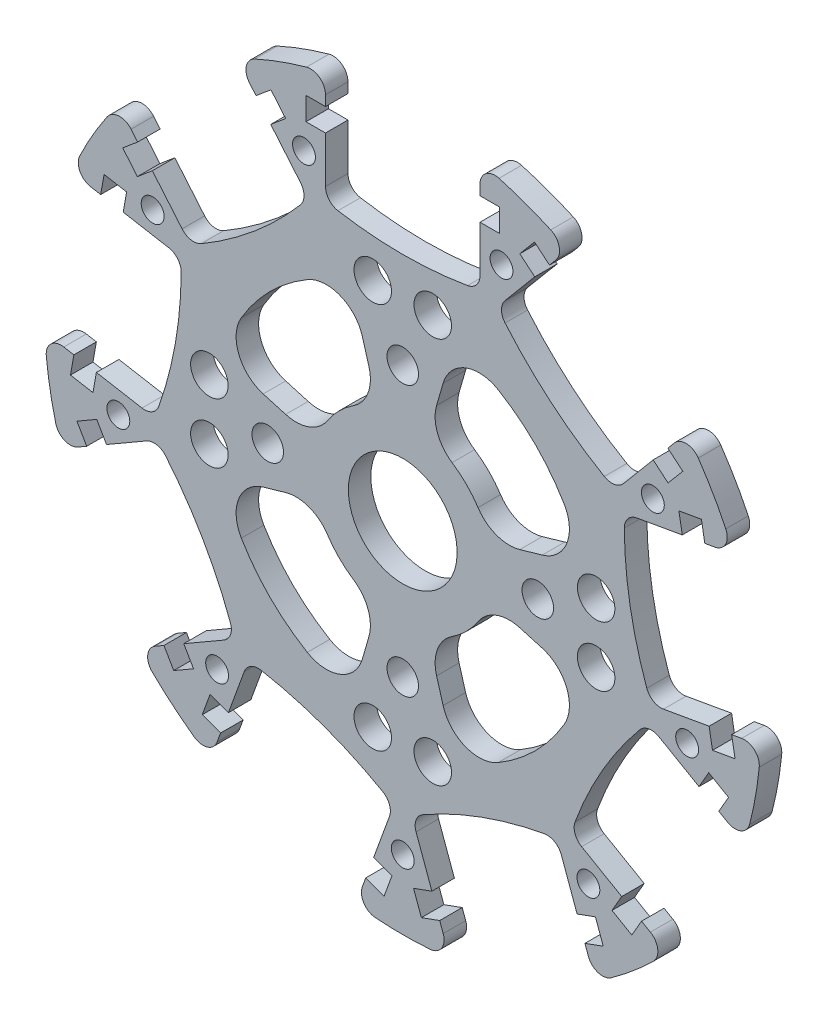
from build123d import *

# Parameters (mm, degrees)
SKETCH_1_R                       = 47.75
EXTRUDE_1_DEPTH                  = 3
CUT_EXTRUDE_1_DEPTH              = 68.595303091
FILLET_2_R                       = 2
SKETCH_3_R                       = 1.525
CUT_EXTRUDE_2_DEPTH              = 68.441458022
SKETCH_4_R                       = 2.1
SKETCH_4_R_2                     = 7.25
CUT_EXTRUDE_3_DEPTH              = 68.441458022
CUT_EXTRUDE_4_DEPTH              = 68.441458022
FILLET_3_R                       = 5
PATTERN_CIRCULAR_1_COUNT         = 4
FILLET_3_OF_PATTERN_CIRCULAR_1_R = 5
SKETCH_8_R                       = 2.5
CUT_EXTRUDE_5_DEPTH              = 68.441458022
PATTERN_CIRCULAR_2_COUNT         = 4


with BuildPart() as part:
    # ｽｹｯﾁ1 → ﾎﾞｽ - 押し出し1 (new body)
    with BuildSketch(Plane.XY):
        Circle(SKETCH_1_R)
    extrude(amount=EXTRUDE_1_DEPTH)

    # ｽｹｯﾁ2 → ｶｯﾄ - 押し出し1 (cut, through all)
    with BuildSketch(Plane.XY.offset(3)):
        with BuildLine():
            Line((-10.3, 46.625878008), (-10.3, 42.705))
            Line((-10.3, 42.705), (-12.9, 42.705))
            Line((-12.9, 42.705), (-12.9, 39.655))
            Line((-12.9, 39.655), (-10.3, 39.655))
            Line((-10.3, 39.655), (-10.3, 31.825692416))
            ThreePointArc((-10.3, 31.825692416), (0, 30.78), (10.3, 31.825692416))
            Line((10.3, 31.825692416), (10.3, 39.655))
            Line((10.3, 39.655), (12.9, 39.655))
            Line((12.9, 39.655), (12.9, 42.705))
            Line((12.9, 42.705), (10.3, 42.705))
            Line((10.3, 42.705), (10.3, 46.625878008))
            ThreePointArc((10.3, 46.625878008), (0, 47.75), (-10.3, 46.625878008))
        make_face()
        with BuildLine():
            Line((17.599484898, 36.998204772), (12.566902991, 31.000607203))
            ThreePointArc((12.566902991, 31.000607203), (19.785002626, 23.578847959), (28.347418519, 17.759182444))
            Line((28.347418519, 17.759182444), (33.380000426, 23.756780012))
            Line((33.380000426, 23.756780012), (35.371715978, 22.085532227))
            Line((35.371715978, 22.085532227), (37.332218188, 24.421967778))
            Line((37.332218188, 24.421967778), (35.340502636, 26.093215564))
            Line((35.340502636, 26.093215564), (37.860794438, 29.096782374))
            ThreePointArc((37.860794438, 29.096782374), (30.693108363, 36.578622159), (22.08027891, 42.338207133))
            Line((22.08027891, 42.338207133), (19.559987108, 39.334640323))
            Line((19.559987108, 39.334640323), (17.568271555, 41.005888108))
            Line((17.568271555, 41.005888108), (15.607769346, 38.669452557))
            Line((15.607769346, 38.669452557), (17.599484898, 36.998204772))
        make_face()
        with BuildLine():
            Line((37.263975216, 17.029538341), (29.553612406, 15.669993347))
            ThreePointArc((29.553612406, 15.669993347), (30.312382638, 5.344890909), (33.130764866, -4.617046365))
            Line((33.130764866, -4.617046365), (40.841127676, -3.257501371))
            Line((40.841127676, -3.257501371), (41.292612938, -5.818001528))
            Line((41.292612938, -5.818001528), (44.296276584, -5.288374587))
            Line((44.296276584, -5.288374587), (43.844791322, -2.727874429))
            Line((43.844791322, -2.727874429), (47.706102383, -2.047021108))
            ThreePointArc((47.706102383, -2.047021108), (47.024570206, 8.291700484), (44.128949923, 18.240018604))
            Line((44.128949923, 18.240018604), (40.267638862, 17.559165283))
            Line((40.267638862, 17.559165283), (39.8161536, 20.119665441))
            Line((39.8161536, 20.119665441), (36.812489954, 19.590038499))
            Line((36.812489954, 19.590038499), (37.263975216, 17.029538341))
        make_face()
        with BuildLine():
            Line((39.492237387, -10.907438341), (32.711858125, -6.992784549))
            ThreePointArc((32.711858125, -6.992784549), (26.656261928, -15.39), (22.411858125, -24.832907867))
            Line((22.411858125, -24.832907867), (29.192237387, -28.747561659))
            Line((29.192237387, -28.747561659), (27.892237387, -30.999227709))
            Line((27.892237387, -30.999227709), (30.533614869, -32.524227709))
            Line((30.533614869, -32.524227709), (31.833614869, -30.272561659))
            Line((31.833614869, -30.272561659), (35.229194829, -32.233000663))
            ThreePointArc((35.229194829, -32.233000663), (41.352713031, -23.875), (45.529194829, -14.392877345))
            Line((45.529194829, -14.392877345), (42.133614869, -12.432438341))
            Line((42.133614869, -12.432438341), (43.433614869, -10.180772291))
            Line((43.433614869, -10.180772291), (40.792237387, -8.655772291))
            Line((40.792237387, -8.655772291), (39.492237387, -10.907438341))
        make_face()
        with BuildLine():
            Line((23.241642778, -33.740703401), (20.563861876, -26.383560838))
            ThreePointArc((20.563861876, -26.383560838), (10.527380012, -28.923738868), (1.206193887, -33.429175791))
            Line((1.206193887, -33.429175791), (3.883974789, -40.786318354))
            Line((3.883974789, -40.786318354), (1.440773975, -41.675570726))
            Line((1.440773975, -41.675570726), (2.483935413, -44.54163322))
            Line((2.483935413, -44.54163322), (4.927136227, -43.652380847))
            Line((4.927136227, -43.652380847), (6.268155485, -47.336800978))
            ThreePointArc((6.268155485, -47.336800978), (16.331461844, -44.870322643), (25.625823473, -40.291186025))
            Line((25.625823473, -40.291186025), (24.284804215, -36.606765894))
            Line((24.284804215, -36.606765894), (26.728005029, -35.717513522))
            Line((26.728005029, -35.717513522), (25.684843592, -32.851451028))
            Line((25.684843592, -32.851451028), (23.241642778, -33.740703401))
        make_face()
        with BuildLine():
            Line((-3.883974789, -40.786318354), (-1.206193887, -33.429175791))
            ThreePointArc((-1.206193887, -33.429175791), (-10.527380012, -28.923738868), (-20.563861876, -26.383560838))
            Line((-20.563861876, -26.383560838), (-23.241642778, -33.740703401))
            Line((-23.241642778, -33.740703401), (-25.684843592, -32.851451028))
            Line((-25.684843592, -32.851451028), (-26.728005029, -35.717513522))
            Line((-26.728005029, -35.717513522), (-24.284804215, -36.606765894))
            Line((-24.284804215, -36.606765894), (-25.625823473, -40.291186025))
            ThreePointArc((-25.625823473, -40.291186025), (-16.331461844, -44.870322643), (-6.268155485, -47.336800978))
            Line((-6.268155485, -47.336800978), (-4.927136227, -43.652380847))
            Line((-4.927136227, -43.652380847), (-2.483935413, -44.54163322))
            Line((-2.483935413, -44.54163322), (-1.440773975, -41.675570726))
            Line((-1.440773975, -41.675570726), (-3.883974789, -40.786318354))
        make_face()
        with BuildLine():
            Line((-29.192237387, -28.747561659), (-22.411858125, -24.832907867))
            ThreePointArc((-22.411858125, -24.832907867), (-26.656261928, -15.39), (-32.711858125, -6.992784549))
            Line((-32.711858125, -6.992784549), (-39.492237387, -10.907438341))
            Line((-39.492237387, -10.907438341), (-40.792237387, -8.655772291))
            Line((-40.792237387, -8.655772291), (-43.433614869, -10.180772291))
            Line((-43.433614869, -10.180772291), (-42.133614869, -12.432438341))
            Line((-42.133614869, -12.432438341), (-45.529194829, -14.392877345))
            ThreePointArc((-45.529194829, -14.392877345), (-41.352713031, -23.875), (-35.229194829, -32.233000663))
            Line((-35.229194829, -32.233000663), (-31.833614869, -30.272561659))
            Line((-31.833614869, -30.272561659), (-30.533614869, -32.524227709))
            Line((-30.533614869, -32.524227709), (-27.892237387, -30.999227709))
            Line((-27.892237387, -30.999227709), (-29.192237387, -28.747561659))
        make_face()
        with BuildLine():
            Line((-40.841127676, -3.257501371), (-33.130764866, -4.617046365))
            ThreePointArc((-33.130764866, -4.617046365), (-30.312382638, 5.344890909), (-29.553612406, 15.669993347))
            Line((-29.553612406, 15.669993347), (-37.263975216, 17.029538341))
            Line((-37.263975216, 17.029538341), (-36.812489954, 19.590038499))
            Line((-36.812489954, 19.590038499), (-39.8161536, 20.119665441))
            Line((-39.8161536, 20.119665441), (-40.267638862, 17.559165283))
            Line((-40.267638862, 17.559165283), (-44.128949923, 18.240018604))
            ThreePointArc((-44.128949923, 18.240018604), (-47.024570206, 8.291700484), (-47.706102383, -2.047021108))
            Line((-47.706102383, -2.047021108), (-43.844791322, -2.727874429))
            Line((-43.844791322, -2.727874429), (-44.296276584, -5.288374587))
            Line((-44.296276584, -5.288374587), (-41.292612938, -5.818001528))
            Line((-41.292612938, -5.818001528), (-40.841127676, -3.257501371))
        make_face()
        with BuildLine():
            Line((-33.380000426, 23.756780012), (-28.347418519, 17.759182444))
            ThreePointArc((-28.347418519, 17.759182444), (-19.785002626, 23.578847959), (-12.566902991, 31.000607203))
            Line((-12.566902991, 31.000607203), (-17.599484898, 36.998204772))
            Line((-17.599484898, 36.998204772), (-15.607769346, 38.669452557))
            Line((-15.607769346, 38.669452557), (-17.568271555, 41.005888108))
            Line((-17.568271555, 41.005888108), (-19.559987108, 39.334640323))
            Line((-19.559987108, 39.334640323), (-22.08027891, 42.338207133))
            ThreePointArc((-22.08027891, 42.338207133), (-30.693108363, 36.578622159), (-37.860794438, 29.096782374))
            Line((-37.860794438, 29.096782374), (-35.340502636, 26.093215564))
            Line((-35.340502636, 26.093215564), (-37.332218188, 24.421967778))
            Line((-37.332218188, 24.421967778), (-35.371715978, 22.085532227))
            Line((-35.371715978, 22.085532227), (-33.380000426, 23.756780012))
        make_face()
    extrude(amount=-CUT_EXTRUDE_1_DEPTH, mode=Mode.SUBTRACT)

    # ﾌｨﾚｯﾄ2
    fillet_2_edges = [part.edges().sort_by_distance(p)[0] for p in [
        (-47.706102383, -2.047021108, 1.5),
        (-44.128949923, 18.240018604, 1.5),
        (-29.553612406, 15.669993347, 1.5),
        (-33.130764866, -4.617046365, 1.5),
        (-37.860794438, 29.096782374, 1.5),
        (-22.08027891, 42.338207133, 1.5),
        (-12.566902991, 31.000607203, 1.5),
        (-28.347418519, 17.759182444, 1.5),
        (-6.268155485, -47.336800978, 1.5),
        (-25.625823473, -40.291186025, 1.5),
        (-20.563861876, -26.383560838, 1.5),
        (-1.206193887, -33.429175791, 1.5),
        (-35.229194829, -32.233000663, 1.5),
        (-45.529194829, -14.392877345, 1.5),
        (-32.711858125, -6.992784549, 1.5),
        (-22.411858125, -24.832907867, 1.5),
        (45.529194829, -14.392877345, 1.5),
        (35.229194829, -32.233000663, 1.5),
        (22.411858125, -24.832907867, 1.5),
        (32.711858125, -6.992784549, 1.5),
        (25.625823473, -40.291186025, 1.5),
        (6.268155485, -47.336800978, 1.5),
        (1.206193887, -33.429175791, 1.5),
        (20.563861876, -26.383560838, 1.5),
        (22.08027891, 42.338207133, 1.5),
        (37.860794438, 29.096782374, 1.5),
        (28.347418519, 17.759182444, 1.5),
        (12.566902991, 31.000607203, 1.5),
        (44.128949923, 18.240018604, 1.5),
        (47.706102383, -2.047021108, 1.5),
        (33.130764866, -4.617046365, 1.5),
        (29.553612406, 15.669993347, 1.5),
        (-10.3, 46.625878008, 1.5),
        (10.3, 46.625878008, 1.5),
        (10.3, 31.825692416, 1.5),
        (-10.3, 31.825692416, 1.5),
    ]]
    fillet(fillet_2_edges, radius=FILLET_2_R)

    # ｽｹｯﾁ3 → ｶｯﾄ - 押し出し2 (cut, through all)
    with BuildSketch(Plane.XY.offset(3)):
        with Locations((0, -38.5)):
            Circle(SKETCH_3_R)
        with Locations((-24.747322973, -29.49271106)):
            Circle(SKETCH_3_R)
        with Locations((-37.915098491, -6.68545484)):
            Circle(SKETCH_3_R)
        with Locations((-33.341978046, 19.25)):
            Circle(SKETCH_3_R)
        with Locations((-13.167775518, 36.1781659)):
            Circle(SKETCH_3_R)
        with Locations((13.167775518, 36.1781659)):
            Circle(SKETCH_3_R)
        with Locations((33.341978046, 19.25)):
            Circle(SKETCH_3_R)
        with Locations((37.915098491, -6.68545484)):
            Circle(SKETCH_3_R)
        with Locations((24.747322973, -29.49271106)):
            Circle(SKETCH_3_R)
    extrude(amount=-CUT_EXTRUDE_2_DEPTH, mode=Mode.SUBTRACT)

    # ｽｹｯﾁ4 → ｶｯﾄ - 押し出し3 (cut, through all)
    with BuildSketch(Plane(origin=(0, 0, 0), x_dir=(-1, 0, 0), z_dir=(0, 0, -1))):
        with Locations((18, 0)):
            Circle(SKETCH_4_R)
        with Locations((0, -18)):
            Circle(SKETCH_4_R)
        with Locations((0, 18)):
            Circle(SKETCH_4_R)
        Circle(SKETCH_4_R_2)
        with Locations((-18, 0)):
            Circle(SKETCH_4_R)
    extrude(amount=-CUT_EXTRUDE_3_DEPTH, mode=Mode.SUBTRACT)

    # ｽｹｯﾁ7 → ｶｯﾄ - 押し出し4 (cut, through all)
    with BuildSketch(Plane(origin=(0, 0, 0), x_dir=(-1, 0, 0), z_dir=(0, 0, -1))):
        with BuildLine():
            Line((-3.333333333, 11.527744311), (-6.944444444, 24.01613398))
            ThreePointArc((-6.944444444, 24.01613398), (-17.67766953, 17.67766953), (-24.01613398, 6.944444444))
            Line((-24.01613398, 6.944444444), (-11.527744311, 3.333333333))
            ThreePointArc((-11.527744311, 3.333333333), (-8.485281374, 8.485281374), (-3.333333333, 11.527744311))
        make_face()
    cut_extrude_4 = extrude(amount=-CUT_EXTRUDE_4_DEPTH, mode=Mode.SUBTRACT)

    # ﾌｨﾚｯﾄ3
    fillet_3_edges = [part.edges().sort_by_distance(p)[0] for p in [
        (3.333333333, 11.527744311, 1.5),
        (11.527744311, 3.333333333, 1.5),
        (24.01613398, 6.944444444, 1.5),
        (6.944444444, 24.01613398, 1.5),
    ]]
    fillet(fillet_3_edges, radius=FILLET_3_R)

    # 円形ﾊﾟﾀｰﾝ1: ｶｯﾄ - 押し出し4 ×4 about axis
    pattern_circular_1_axis = Axis((0, 0, 0), (0, 0, 1))
    for i in range(1, PATTERN_CIRCULAR_1_COUNT):
        add(cut_extrude_4.rotate(pattern_circular_1_axis, i * 360 / PATTERN_CIRCULAR_1_COUNT), mode=Mode.SUBTRACT)

    # ﾌｨﾚｯﾄ3 of 円形ﾊﾟﾀｰﾝ1
    fillet_3_of_pattern_circular_1_edges = [part.edges().sort_by_distance(p)[0] for p in [
        (-11.527744311, 3.333333333, 1.5),
        (-3.333333333, 11.527744311, 1.5),
        (-6.944444444, 24.01613398, 1.5),
        (-24.01613398, 6.944444444, 1.5),
        (-3.333333333, -11.527744311, 1.5),
        (-11.527744311, -3.333333333, 1.5),
        (-24.01613398, -6.944444444, 1.5),
        (-6.944444444, -24.01613398, 1.5),
        (11.527744311, -3.333333333, 1.5),
        (3.333333333, -11.527744311, 1.5),
        (6.944444444, -24.01613398, 1.5),
        (24.01613398, -6.944444444, 1.5),
    ]]
    fillet(fillet_3_of_pattern_circular_1_edges, radius=FILLET_3_OF_PATTERN_CIRCULAR_1_R)

    # ｽｹｯﾁ8 → ｶｯﾄ - 押し出し5 (cut, through all)
    with BuildSketch(Plane(origin=(0, 0, 0), x_dir=(-1, 0, 0), z_dir=(0, 0, -1))):
        with Locations((-4, 25.78)):
            Circle(SKETCH_8_R)
        with Locations((4, 25.78)):
            Circle(SKETCH_8_R)
    cut_extrude_5 = extrude(amount=-CUT_EXTRUDE_5_DEPTH, mode=Mode.SUBTRACT)

    # 円形ﾊﾟﾀｰﾝ2: ｶｯﾄ - 押し出し5 ×4 about axis
    pattern_circular_2_axis = Axis((0, 0, 0), (0, 0, 1))
    for i in range(1, PATTERN_CIRCULAR_2_COUNT):
        add(cut_extrude_5.rotate(pattern_circular_2_axis, i * 360 / PATTERN_CIRCULAR_2_COUNT), mode=Mode.SUBTRACT)


solid = part.part
